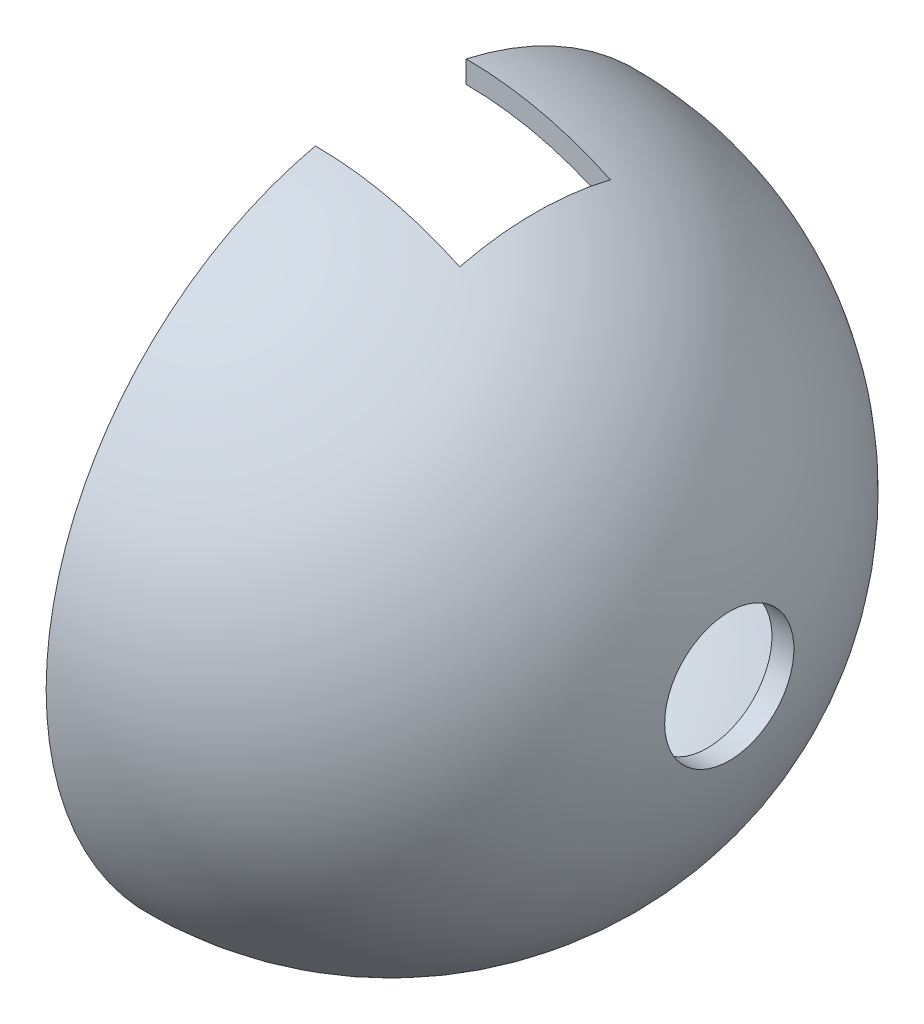
from build123d import *

# Parameters (mm, degrees)
REVOLVE_2_ANGLE     = 180
SKETCH_3_R          = 3
CUT_EXTRUDE_1_DEPTH = 10
SKETCH_4_W          = 6.7
SKETCH_4_H          = 7
CUT_EXTRUDE_2_DEPTH = 20


with BuildPart() as part:
    # 草图1 → 旋转2 (revolve)
    with BuildSketch(Plane(origin=(0, 0, 0), x_dir=(0, 0, -1), z_dir=(1, 0, 0))):
        with BuildLine():
            Line((-16, 0), (-15, 0))
            ThreePointArc((-15, 0), (0, 15), (15, 0))
            Line((15, 0), (16, 0))
            ThreePointArc((16, 0), (0, 16), (-16, 0))
        make_face()
    revolve(axis=Axis((0, 0, -15), (0, 0, -1)), revolution_arc=REVOLVE_2_ANGLE)

    # 草图3 → 切除-拉伸1 (cut)
    with BuildSketch(Plane(origin=(20.295894922, 0, 0), x_dir=(0, 0, -1), z_dir=(1, 0, 0))):
        with Locations(Location((0, 0, 0), (0, 0, 180))):
            Circle(SKETCH_3_R)
    extrude(amount=-CUT_EXTRUDE_1_DEPTH, mode=Mode.SUBTRACT)

    # 草图4 → 切除-拉伸2 (cut)
    with BuildSketch(Plane(origin=(0, 27.814479009, 0), x_dir=(1, 0, 0), z_dir=(0, 1, 0))):
        with Locations((3.35, 0)):
            Rectangle(SKETCH_4_W, SKETCH_4_H)
    extrude(amount=-CUT_EXTRUDE_2_DEPTH, mode=Mode.SUBTRACT)


solid = part.part
